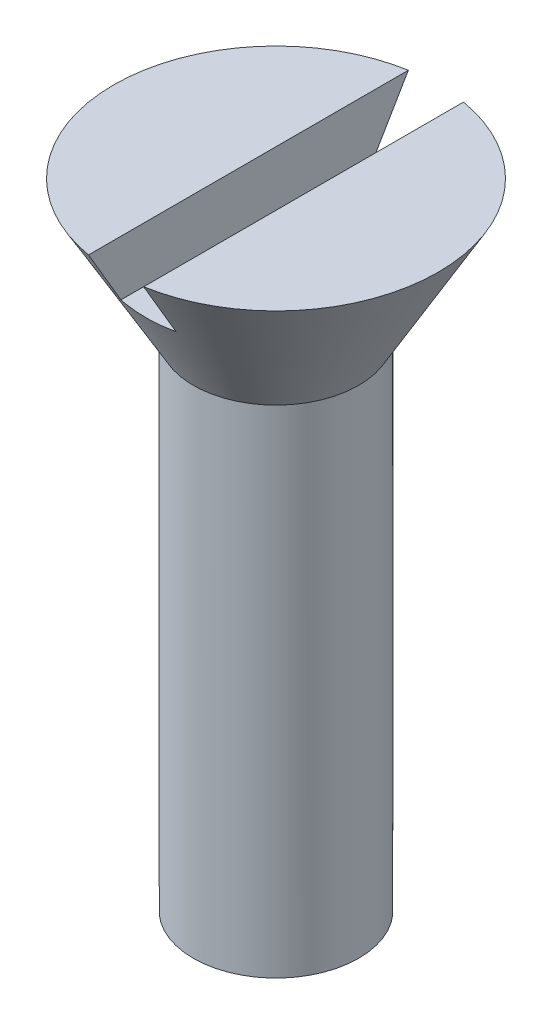
from build123d import *

# Parameters (mm, degrees)
EXTRUDE1_REACH             = 26.46
SKETCH2_W                  = 2
SKETCH2_H                  = 2
EXTRUDE1_DIRECTION_2_REACH = 26.46


with BuildPart() as part:
    # Sketch1 → Revolve1 (revolve)
    with BuildSketch(Plane.XY, mode=Mode.PRIVATE) as revolve1_sk:
        Polygon((-3, 0), (-3, 18), (-5.886751346, 23), (0, 23), (0, 0), (0, -1.732050808), align=None)
    revolve(revolve1_sk.sketch.rotate(Axis((0, 0, 0), (0, 1, 0)), 270), axis=Axis((0, 0, 0), (0, 1, 0)))

    # Extrude1: up to this cone (the profile starts inside it)
    extrude1_end = Plane(origin=(0, 22, 0), z_dir=(0, 1, 0)).offset(-9.196151423) * Cone(1e-06, 23.940148475, 41.465552499, align=(Align.CENTER, Align.CENTER, Align.MIN), mode=Mode.PRIVATE)
    # Sketch2 → Extrude1 (cut, up to the surface)
    with BuildSketch(Plane.XY, mode=Mode.PRIVATE) as extrude1_sk1:
        with Locations((0, 22)):
            Rectangle(SKETCH2_W, SKETCH2_H)
    extrude1_tool1 = extrude(extrude1_sk1.sketch, amount=-EXTRUDE1_REACH, mode=Mode.PRIVATE) & extrude1_end
    add(extrude1_tool1.solids().sort_by_distance((0, 22, 0))[0], mode=Mode.SUBTRACT)

    # Extrude1 direction 2: up to this cone (the profile starts inside it)
    extrude1_direction_2_end = Plane(origin=(0, 22, 0), z_dir=(0, 1, 0)).offset(-9.196151423) * Cone(1e-06, 23.940148475, 41.465552499, align=(Align.CENTER, Align.CENTER, Align.MIN), mode=Mode.PRIVATE)
    # Sketch2 → Extrude1 direction 2 (cut, up to the surface)
    with BuildSketch(Plane.XY, mode=Mode.PRIVATE) as extrude1_direction_2_sk1:
        with Locations((0, 22)):
            Rectangle(SKETCH2_W, SKETCH2_H)
    extrude1_direction_2_tool1 = extrude(extrude1_direction_2_sk1.sketch, amount=EXTRUDE1_DIRECTION_2_REACH, mode=Mode.PRIVATE) & extrude1_direction_2_end
    add(extrude1_direction_2_tool1.solids().sort_by_distance((0, 22, 0))[0], mode=Mode.SUBTRACT)


solid = part.part
